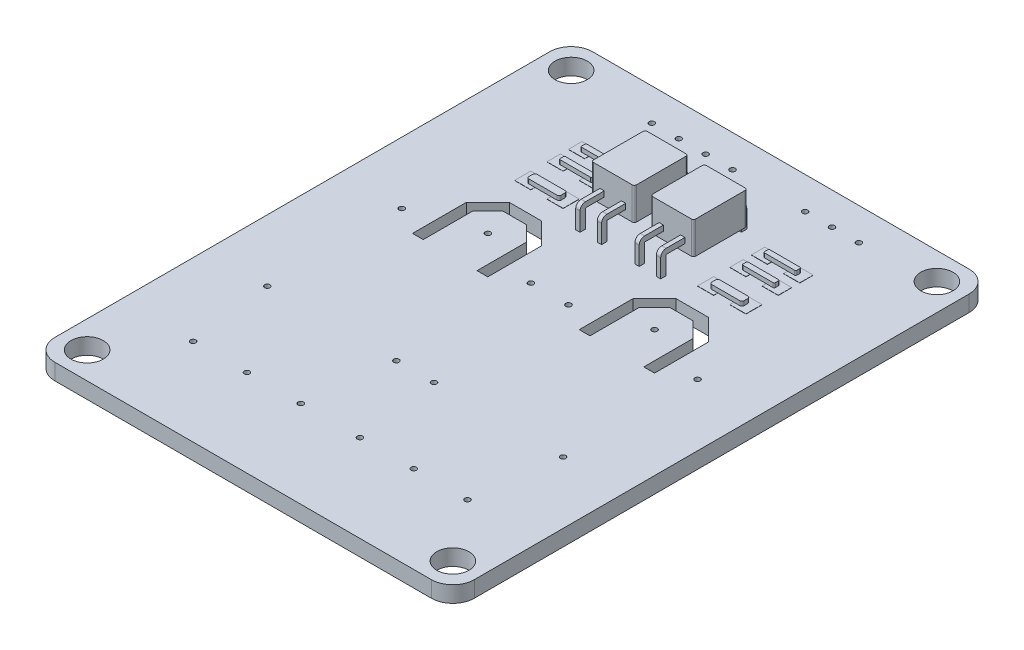
from build123d import *

# Parameters (mm, degrees)
IZIM1_R                          = 1.5
IZIM1_R_2                        = 0.25
Y_KSEKLIK_EKSTR_ZYON1_DEPTH      = 1.5
IZIM2_W                          = 1.5
IZIM2_H                          = 1.5
IZIM2_H_2                        = 1.25
Y_KSEKLIK_EKSTR_ZYON2_DEPTH      = 0.02
Y_KSEKLIK_EKSTR_ZYON3_DEPTH      = 0.4
Y_KSEKLIK_EKSTR_ZYON4_DEPTH      = 3
Y_KSEKLIK_EKSTR_ZYON4_2_DEPTH    = 3
Y_KSEKLIK_EKSTR_ZYON5_DEPTH      = 0.2
Y_KSEKLIK_EKSTR_ZYON5_DEPTH_BACK = 0.2
Y_KSEKLIK_EKSTR_ZYON6_DEPTH      = 0.2
Y_KSEKLIK_EKSTR_ZYON6_DEPTH_BACK = 0.2
Y_KSEKLIK_EKSTR_ZYON7_DEPTH      = 0.2
Y_KSEKLIK_EKSTR_ZYON7_DEPTH_BACK = 0.2
Y_KSEKLIK_EKSTR_ZYON8_DEPTH      = 0.2
Y_KSEKLIK_EKSTR_ZYON8_DEPTH_BACK = 0.2


with BuildPart() as part:
    # Çizim1 → Yükseklik-Ekstrüzyon1 (new body)
    with BuildSketch(Plane(origin=(0, 0, 0), x_dir=(1, 0, 0), z_dir=(0, 1, 0))):
        with BuildLine():
            Line((-17.5, 25), (17.5, 25))
            ThreePointArc((17.5, 25), (18.914213562, 24.414213562), (19.5, 23))
            Line((19.5, 23), (19.5, -23))
            ThreePointArc((19.5, -23), (18.914213562, -24.414213562), (17.5, -25))
            Line((17.5, -25), (-17.5, -25))
            ThreePointArc((-17.5, -25), (-18.914213562, -24.414213562), (-19.5, -23))
            Line((-19.5, -23), (-19.5, 23))
            ThreePointArc((-19.5, 23), (-18.914213562, 24.414213562), (-17.5, 25))
        make_face()
        with Locations(Location((-17, 22.5, 0), (0, 0, 270))):
            Circle(IZIM1_R, mode=Mode.SUBTRACT)
        with Locations(Location((17, 22.5, 0), (0, 0, 90))):
            Circle(IZIM1_R, mode=Mode.SUBTRACT)
        with Locations(Location((17, -22.5, 0), (0, 0, 270))):
            Circle(IZIM1_R, mode=Mode.SUBTRACT)
        with Locations(Location((-17, -22.5, 0), (0, 0, 90))):
            Circle(IZIM1_R, mode=Mode.SUBTRACT)
        with Locations(Location((-13.75, -9, 0), (0, 0, 270))):
            Circle(IZIM1_R_2, mode=Mode.SUBTRACT)
        with Locations(Location((-1.75, -9, 0), (0, 0, 270))):
            Circle(IZIM1_R_2, mode=Mode.SUBTRACT)
        with Locations(Location((-13.75, 3.5, 0), (0, 0, 270))):
            Circle(IZIM1_R_2, mode=Mode.SUBTRACT)
        with Locations(Location((-7.75, 5.5, 0), (0, 0, 270))):
            Circle(IZIM1_R_2, mode=Mode.SUBTRACT)
        with Locations(Location((-1.75, 3.5, 0), (0, 0, 270))):
            Circle(IZIM1_R_2, mode=Mode.SUBTRACT)
        with Locations(Location((13.75, 3.5, 0), (0, 0, 90))):
            Circle(IZIM1_R_2, mode=Mode.SUBTRACT)
        with Locations(Location((7.75, 5.5, 0), (0, 0, 90))):
            Circle(IZIM1_R_2, mode=Mode.SUBTRACT)
        with Locations(Location((1.75, 3.5, 0), (0, 0, 90))):
            Circle(IZIM1_R_2, mode=Mode.SUBTRACT)
        with Locations(Location((1.75, -9, 0), (0, 0, 90))):
            Circle(IZIM1_R_2, mode=Mode.SUBTRACT)
        with Locations(Location((13.75, -9, 0), (0, 0, 90))):
            Circle(IZIM1_R_2, mode=Mode.SUBTRACT)
        with Locations(Location((-7.75, -16.89, 0), (0, 0, 270))):
            Circle(IZIM1_R_2, mode=Mode.SUBTRACT)
        with Locations(Location((-2.75, -16.89, 0), (0, 0, 270))):
            Circle(IZIM1_R_2, mode=Mode.SUBTRACT)
        with Locations(Location((-12.75, -16.89, 0), (0, 0, 270))):
            Circle(IZIM1_R_2, mode=Mode.SUBTRACT)
        with Locations(Location((2.75, -16.89, 0), (0, 0, 90))):
            Circle(IZIM1_R_2, mode=Mode.SUBTRACT)
        with Locations(Location((7.75, -16.89, 0), (0, 0, 90))):
            Circle(IZIM1_R_2, mode=Mode.SUBTRACT)
        with Locations(Location((12.75, -16.89, 0), (0, 0, 90))):
            Circle(IZIM1_R_2, mode=Mode.SUBTRACT)
        with Locations(Location((-1.5, 22, 0), (0, 0, 270))):
            Circle(IZIM1_R_2, mode=Mode.SUBTRACT)
        with Locations(Location((-4, 22, 0), (0, 0, 270))):
            Circle(IZIM1_R_2, mode=Mode.SUBTRACT)
        with Locations(Location((-6.5, 22, 0), (0, 0, 270))):
            Circle(IZIM1_R_2, mode=Mode.SUBTRACT)
        with Locations(Location((-9, 22, 0), (0, 0, 270))):
            Circle(IZIM1_R_2, mode=Mode.SUBTRACT)
        with Locations(Location((7.75, 22, 0), (0, 0, 270))):
            Circle(IZIM1_R_2, mode=Mode.SUBTRACT)
        with Locations(Location((10.25, 22, 0), (0, 0, 270))):
            Circle(IZIM1_R_2, mode=Mode.SUBTRACT)
        with Locations(Location((5.25, 22, 0), (0, 0, 270))):
            Circle(IZIM1_R_2, mode=Mode.SUBTRACT)
        Polygon((-11.25, 7), (-9.25, 9), (-6.25, 9), (-4.25, 7), (-4.25, 2), (-5.25, 2), (-5.25, 6.585786438), (-6.664213562, 8), (-8.835786438, 8), (-10.25, 6.585786438), (-10.25, 2), (-11.25, 2), align=None, mode=Mode.SUBTRACT)
        Polygon((5.25, 2), (4.25, 2), (4.25, 7), (6.25, 9), (9.25, 9), (11.25, 7), (11.25, 2), (10.25, 2), (10.25, 6.585786438), (8.835786438, 8), (6.664213562, 8), (5.25, 6.585786438), align=None, mode=Mode.SUBTRACT)
    extrude(amount=Y_KSEKLIK_EKSTR_ZYON1_DEPTH)

    # Çizim2 → Yükseklik-Ekstrüzyon2 (add)
    with BuildSketch(Plane(origin=(0, 1.5, 0), x_dir=(1, 0, 0), z_dir=(0, 1, 0))):
        with Locations((7, 11.75)):
            Rectangle(IZIM2_W, IZIM2_H)
        with Locations((-7, 11.75)):
            Rectangle(IZIM2_W, IZIM2_H)
        with Locations((-10, 11.75)):
            Rectangle(IZIM2_W, IZIM2_H)
        with Locations((-7, 14.625)):
            Rectangle(IZIM2_W, IZIM2_H_2)
        with Locations((-10, 14.625)):
            Rectangle(IZIM2_W, IZIM2_H_2)
        with Locations((-7, 16.625)):
            Rectangle(IZIM2_W, IZIM2_H_2)
        with Locations((-10, 16.625)):
            Rectangle(IZIM2_W, IZIM2_H_2)
        with Locations((10, 11.75)):
            Rectangle(IZIM2_W, IZIM2_H)
        with Locations((7, 14.625)):
            Rectangle(IZIM2_W, IZIM2_H_2)
        with Locations((10, 14.625)):
            Rectangle(IZIM2_W, IZIM2_H_2)
        with Locations((7, 16.625)):
            Rectangle(IZIM2_W, IZIM2_H_2)
        with Locations((10, 16.625)):
            Rectangle(IZIM2_W, IZIM2_H_2)
    extrude(amount=Y_KSEKLIK_EKSTR_ZYON2_DEPTH)

    # Çizim3 → Yükseklik-Ekstrüzyon3 (add)
    with BuildSketch(Plane(origin=(0, 1.52, 0), x_dir=(1, 0, 0), z_dir=(0, 1, 0))):
        with BuildLine():
            Line((-9.9, 16.875), (-7.1, 16.875))
            ThreePointArc((-7.1, 16.875), (-7.029289322, 16.845710678), (-7, 16.775))
            Line((-7, 16.775), (-7, 16.475))
            ThreePointArc((-7, 16.475), (-7.029289322, 16.404289322), (-7.1, 16.375))
            Line((-7.1, 16.375), (-9.9, 16.375))
            ThreePointArc((-9.9, 16.375), (-9.970710678, 16.404289322), (-10, 16.475))
            Line((-10, 16.475), (-10, 16.775))
            ThreePointArc((-10, 16.775), (-9.970710678, 16.845710678), (-9.9, 16.875))
        make_face()
        with BuildLine():
            Line((-9.9, 14.875), (-7.1, 14.875))
            ThreePointArc((-7.1, 14.875), (-7.029289322, 14.845710678), (-7, 14.775))
            Line((-7, 14.775), (-7, 14.475))
            ThreePointArc((-7, 14.475), (-7.029289322, 14.404289322), (-7.1, 14.375))
            Line((-7.1, 14.375), (-9.9, 14.375))
            ThreePointArc((-9.9, 14.375), (-9.970710678, 14.404289322), (-10, 14.475))
            Line((-10, 14.475), (-10, 14.775))
            ThreePointArc((-10, 14.775), (-9.970710678, 14.845710678), (-9.9, 14.875))
        make_face()
        with BuildLine():
            Line((-9.8, 12.125), (-7.2, 12.125))
            ThreePointArc((-7.2, 12.125), (-7.058578644, 12.066421356), (-7, 11.925))
            Line((-7, 11.925), (-7, 11.575))
            ThreePointArc((-7, 11.575), (-7.058578644, 11.433578644), (-7.2, 11.375))
            Line((-7.2, 11.375), (-9.8, 11.375))
            ThreePointArc((-9.8, 11.375), (-9.941421356, 11.433578644), (-10, 11.575))
            Line((-10, 11.575), (-10, 11.925))
            ThreePointArc((-10, 11.925), (-9.941421356, 12.066421356), (-9.8, 12.125))
        make_face()
        with BuildLine():
            Line((9.9, 16.375), (7.1, 16.375))
            ThreePointArc((7.1, 16.375), (7.029289322, 16.404289322), (7, 16.475))
            Line((7, 16.475), (7, 16.775))
            ThreePointArc((7, 16.775), (7.029289322, 16.845710678), (7.1, 16.875))
            Line((7.1, 16.875), (9.9, 16.875))
            ThreePointArc((9.9, 16.875), (9.970710678, 16.845710678), (10, 16.775))
            Line((10, 16.775), (10, 16.475))
            ThreePointArc((10, 16.475), (9.970710678, 16.404289322), (9.9, 16.375))
        make_face()
        with BuildLine():
            Line((9.9, 14.375), (7.1, 14.375))
            ThreePointArc((7.1, 14.375), (7.029289322, 14.404289322), (7, 14.475))
            Line((7, 14.475), (7, 14.775))
            ThreePointArc((7, 14.775), (7.029289322, 14.845710678), (7.1, 14.875))
            Line((7.1, 14.875), (9.9, 14.875))
            ThreePointArc((9.9, 14.875), (9.970710678, 14.845710678), (10, 14.775))
            Line((10, 14.775), (10, 14.475))
            ThreePointArc((10, 14.475), (9.970710678, 14.404289322), (9.9, 14.375))
        make_face()
        with BuildLine():
            Line((9.8, 11.375), (7.2, 11.375))
            ThreePointArc((7.2, 11.375), (7.058578644, 11.433578644), (7, 11.575))
            Line((7, 11.575), (7, 11.925))
            ThreePointArc((7, 11.925), (7.058578644, 12.066421356), (7.2, 12.125))
            Line((7.2, 12.125), (9.8, 12.125))
            ThreePointArc((9.8, 12.125), (9.941421356, 12.066421356), (10, 11.925))
            Line((10, 11.925), (10, 11.575))
            ThreePointArc((10, 11.575), (9.941421356, 11.433578644), (9.8, 11.375))
        make_face()
    extrude(amount=Y_KSEKLIK_EKSTR_ZYON3_DEPTH)



with BuildPart() as body_2:
    # Çizim5 → Yükseklik-Ekstrüzyon4 (new body)
    with BuildSketch(Plane(origin=(0, 2.5, 0), x_dir=(1, 0, 0), z_dir=(0, 1, 0))):
        with BuildLine():
            Line((4.55, 12.125), (0.95, 12.125))
            ThreePointArc((0.95, 12.125), (0.808578644, 12.183578644), (0.75, 12.325))
            Line((0.75, 12.325), (0.75, 16.925))
            ThreePointArc((0.75, 16.925), (0.808578644, 17.066421356), (0.95, 17.125))
            Line((0.95, 17.125), (4.55, 17.125))
            ThreePointArc((4.55, 17.125), (4.691421356, 17.066421356), (4.75, 16.925))
            Line((4.75, 16.925), (4.75, 12.325))
            ThreePointArc((4.75, 12.325), (4.691421356, 12.183578644), (4.55, 12.125))
        make_face()
    extrude(amount=Y_KSEKLIK_EKSTR_ZYON4_DEPTH)


with BuildPart() as body_3:
    # Çizim5 → Y_kseklik-Ekstr_zyon4 2 (new body)
    with BuildSketch(Plane(origin=(0, 2.5, 0), x_dir=(1, 0, 0), z_dir=(0, 1, 0))):
        with BuildLine():
            Line((-4.55, 17.125), (-0.95, 17.125))
            ThreePointArc((-0.95, 17.125), (-0.808578644, 17.066421356), (-0.75, 16.925))
            Line((-0.75, 16.925), (-0.75, 12.325))
            ThreePointArc((-0.75, 12.325), (-0.808578644, 12.183578644), (-0.95, 12.125))
            Line((-0.95, 12.125), (-4.55, 12.125))
            ThreePointArc((-4.55, 12.125), (-4.691421356, 12.183578644), (-4.75, 12.325))
            Line((-4.75, 12.325), (-4.75, 16.925))
            ThreePointArc((-4.75, 16.925), (-4.691421356, 17.066421356), (-4.55, 17.125))
        make_face()
    extrude(amount=Y_KSEKLIK_EKSTR_ZYON4_2_DEPTH)


with BuildPart() as part_1:
    add(part.part)

    add(body_3.part)  # Yükseklik-Ekstrüzyon5 merges body 3
    # Çizim8 → Yükseklik-Ekstrüzyon5 (add, two sides: drawn at the far end of the back side and taken through both)
    with BuildSketch(Plane.ZY.offset(3.75).offset(-Y_KSEKLIK_EKSTR_ZYON5_DEPTH_BACK)):
        with BuildLine():
            Line((-17.375, 3.210871737), (-10.375, 3.210871737))
            Line((-10.375, 3.210871737), (-10.375, 0.798774868))
            Line((-10.375, 0.798774868), (-9.875, 0.798774868))
            Line((-9.875, 0.798774868), (-9.875, 3.210871737))
            ThreePointArc((-9.875, 3.210871737), (-10.021446609, 3.564425128), (-10.375, 3.710871737))
            Line((-10.375, 3.710871737), (-17.375, 3.710871737))
            ThreePointArc((-17.375, 3.710871737), (-17.728553391, 3.564425128), (-17.875, 3.210871737))
            Line((-17.875, 3.210871737), (-17.875, 0.798774868))
            Line((-17.875, 0.798774868), (-17.375, 0.798774868))
            Line((-17.375, 0.798774868), (-17.375, 3.210871737))
        make_face()
    extrude(amount=Y_KSEKLIK_EKSTR_ZYON5_DEPTH + Y_KSEKLIK_EKSTR_ZYON5_DEPTH_BACK)

    # Çizim9 → Yükseklik-Ekstrüzyon6 (add, two sides: drawn at the far end of the back side and taken through both)
    with BuildSketch(Plane(origin=(-1.75, 0, 0), x_dir=(0, 0, -1), z_dir=(1, 0, 0)).offset(-Y_KSEKLIK_EKSTR_ZYON6_DEPTH_BACK)):
        with BuildLine():
            Line((10.378377538, 0.559357084), (10.378377538, 3.210871737))
            Line((10.378377538, 3.210871737), (17.371622462, 3.210871737))
            Line((17.371622462, 3.210871737), (17.371622462, 0.559357084))
            Line((17.371622462, 0.559357084), (17.871622462, 0.559357084))
            Line((17.871622462, 0.559357084), (17.871622462, 3.210871737))
            ThreePointArc((17.871622462, 3.210871737), (17.725175853, 3.564425128), (17.371622462, 3.710871737))
            Line((17.371622462, 3.710871737), (10.378377538, 3.710871737))
            ThreePointArc((10.378377538, 3.710871737), (10.024824147, 3.564425128), (9.878377538, 3.210871737))
            Line((9.878377538, 3.210871737), (9.878377538, 0.559357084))
            Line((9.878377538, 0.559357084), (10.378377538, 0.559357084))
        make_face()
    extrude(amount=Y_KSEKLIK_EKSTR_ZYON6_DEPTH + Y_KSEKLIK_EKSTR_ZYON6_DEPTH_BACK)


    add(body_2.part)  # Yükseklik-Ekstrüzyon7 merges body 2
    # Çizim10 → Yükseklik-Ekstrüzyon7 (add, two sides: drawn at the far end of the back side and taken through both)
    with BuildSketch(Plane(origin=(3.75, 0, 0), x_dir=(0, 0, -1), z_dir=(1, 0, 0)).offset(-Y_KSEKLIK_EKSTR_ZYON7_DEPTH_BACK)):
        with BuildLine():
            Line((10.375, 0.625240508), (10.375, 3.2127649))
            Line((10.375, 3.2127649), (17.375, 3.2127649))
            Line((17.375, 3.2127649), (17.375, 0.625240508))
            Line((17.375, 0.625240508), (17.875, 0.625240508))
            Line((17.875, 0.625240508), (17.875, 3.2127649))
            ThreePointArc((17.875, 3.2127649), (17.728553391, 3.56631829), (17.375, 3.7127649))
            Line((17.375, 3.7127649), (10.375, 3.7127649))
            ThreePointArc((10.375, 3.7127649), (10.021446609, 3.56631829), (9.875, 3.2127649))
            Line((9.875, 3.2127649), (9.875, 0.625240508))
            Line((9.875, 0.625240508), (10.375, 0.625240508))
        make_face()
    extrude(amount=Y_KSEKLIK_EKSTR_ZYON7_DEPTH + Y_KSEKLIK_EKSTR_ZYON7_DEPTH_BACK)

    # Çizim11 → Yükseklik-Ekstrüzyon8 (add, two sides: drawn at the far end of the back side and taken through both)
    with BuildSketch(Plane.ZY.offset(-1.75).offset(-Y_KSEKLIK_EKSTR_ZYON8_DEPTH_BACK)):
        with BuildLine():
            Line((-17.375, 0.555982075), (-17.375, 3.210871737))
            Line((-17.375, 3.210871737), (-10.375, 3.210871737))
            Line((-10.375, 3.210871737), (-10.375, 0.555982075))
            Line((-10.375, 0.555982075), (-9.875, 0.555982075))
            Line((-9.875, 0.555982075), (-9.875, 3.210871737))
            ThreePointArc((-9.875, 3.210871737), (-10.021446609, 3.564425128), (-10.375, 3.710871737))
            Line((-10.375, 3.710871737), (-17.375, 3.710871737))
            ThreePointArc((-17.375, 3.710871737), (-17.728553391, 3.564425128), (-17.875, 3.210871737))
            Line((-17.875, 3.210871737), (-17.875, 0.555982075))
            Line((-17.875, 0.555982075), (-17.375, 0.555982075))
        make_face()
    extrude(amount=Y_KSEKLIK_EKSTR_ZYON8_DEPTH + Y_KSEKLIK_EKSTR_ZYON8_DEPTH_BACK)


solid = part_1.part
